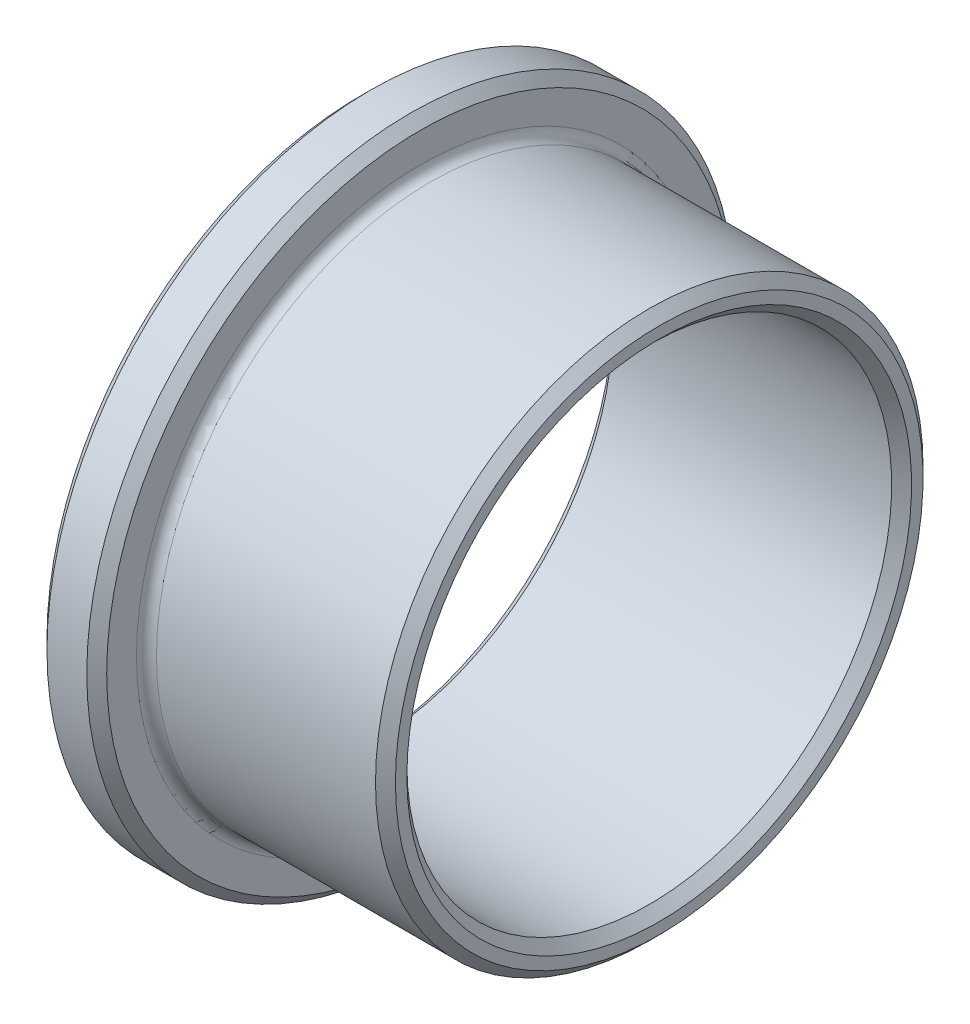
from build123d import *

# Parameters (mm, degrees)
CHAMFER1_SIZE = 1
FILLET1_R     = 1


with BuildPart() as part:
    # Sketch1 → Revolve1 (revolve)
    with BuildSketch(Plane.XY, mode=Mode.PRIVATE) as revolve1_sk:
        Polygon((0, 24.35), (30, 24.35), (30, 27.5), (6, 27.5), (6, 32.5), (0, 32.5), align=None)
    revolve(revolve1_sk.sketch.rotate(Axis((0, 0, 0), (1, 0, 0)), 90), axis=Axis((0, 0, 0), (1, 0, 0)))

    # Chamfer1
    chamfer1_edges = [part.edges().sort_by_distance(p)[0] for p in [
        (0, 0, -32.5),
        (6, 0, -32.5),
        (30, 0, -27.5),
        (30, 0, -24.35),
        (0, 0, -24.35),
    ]]
    chamfer(chamfer1_edges, length=CHAMFER1_SIZE)

    # Fillet1
    fillet1_edges = [part.edges().sort_by_distance(p)[0] for p in [
        (6, 0, -27.5),
    ]]
    fillet(fillet1_edges, radius=FILLET1_R)


solid = part.part
